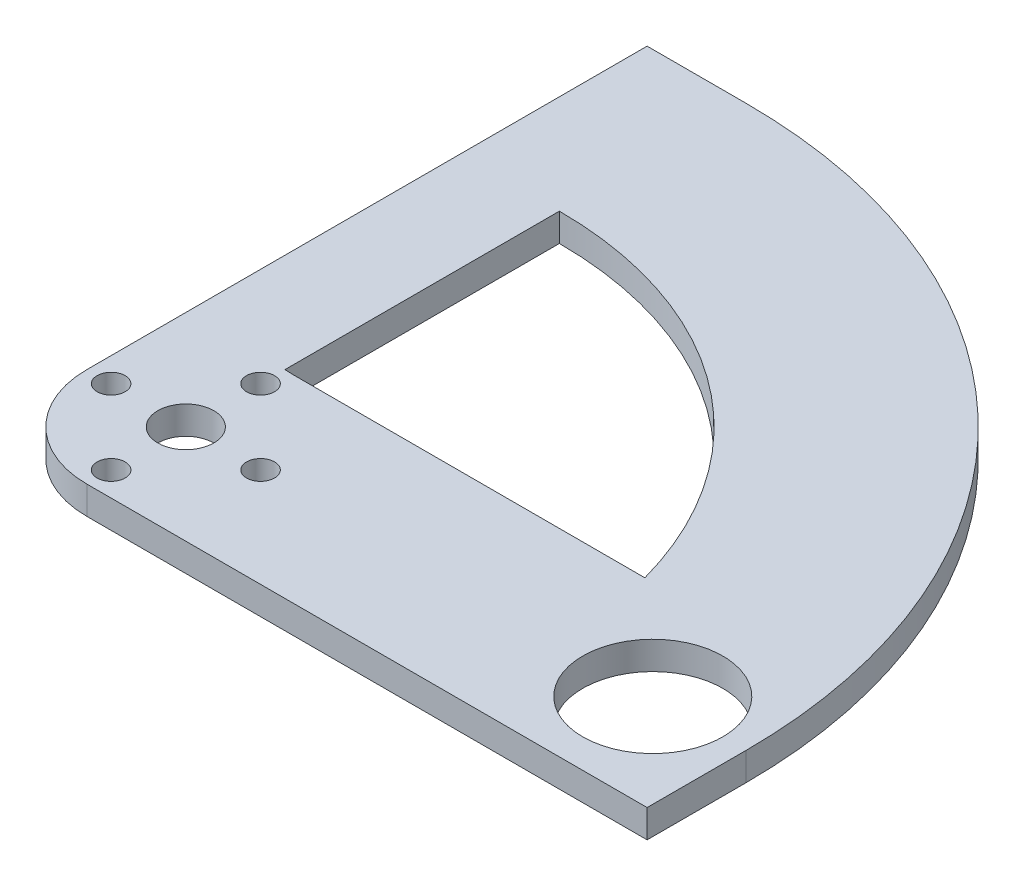
from build123d import *

# Parameters (mm, degrees)
SKETCH1_R             = 3
SKETCH1_R_2           = 7.5
BOSS_EXTRUDE1_DEPTH   = 3
CORTAR_EXTRUIR1_DEPTH = 85.905830189
CROQUIS2_R            = 1.5
CORTAR_EXTRUIR2_DEPTH = 85.905830189


with BuildPart() as part:
    # Sketch1 → Boss-Extrude1 (new body)
    with BuildSketch(Plane(origin=(0, 0, 0), x_dir=(1, 0, 0), z_dir=(0, 1, 0))):
        with BuildLine():
            Line((-10.606601718, 60), (-10.606601718, -10.606601718))
            Line((-10.606601718, -10.606601718), (60, -10.606601718))
            Line((60, -10.606601718), (60, 0))
            ThreePointArc((60, 0), (42.426406871, 42.426406871), (0, 60))
            Line((0, 60), (-10.606601718, 60))
        make_face()
        with Locations(Location((0, 0, 0), (0, 0, 270))):
            Circle(SKETCH1_R, mode=Mode.SUBTRACT)
        with Locations(Location((50, 0, 0), (0, 0, 270))):
            Circle(SKETCH1_R_2, mode=Mode.SUBTRACT)
    extrude(amount=BOSS_EXTRUDE1_DEPTH)

    # Croquis1 → Cortar-Extruir1 (cut, through all)
    with BuildSketch(Plane(origin=(0, 3, 0), x_dir=(1, 0, 0), z_dir=(0, 1, 0))):
        with BuildLine():
            ThreePointArc((0, 10.606601718), (0.38870443, 10.59947682), (0.776886642, 10.5781117))
            Line((0.776886642, 10.5781117), (38.575945262, 10.5781117))
            ThreePointArc((38.575945262, 10.5781117), (24.257736209, 31.805066169), (0, 40))
            Line((0, 40), (0, 10.606601718))
        make_face()
        with BuildLine():
            ThreePointArc((0, -10.606601718), (-7.5, -7.5), (-10.606601718, 0))
            Line((-10.606601718, 0), (-10.606601718, -10.606601718))
            Line((-10.606601718, -10.606601718), (0, -10.606601718))
        make_face()
    extrude(amount=-CORTAR_EXTRUIR1_DEPTH, mode=Mode.SUBTRACT)

    # Croquis2 → Cortar-Extruir2 (cut, through all)
    with BuildSketch(Plane(origin=(0, 3, 0), x_dir=(1, 0, 0), z_dir=(0, 1, 0))):
        with Locations(Location((8, 0, 0), (0, 0, 270))):
            Circle(CROQUIS2_R)
        with Locations(Location((0, -8, 0), (0, 0, 270))):
            Circle(CROQUIS2_R)
        with Locations(Location((-8, 0, 0), (0, 0, 270))):
            Circle(CROQUIS2_R)
        with Locations(Location((0, 8, 0), (0, 0, 270))):
            Circle(CROQUIS2_R)
    extrude(amount=-CORTAR_EXTRUIR2_DEPTH, mode=Mode.SUBTRACT)


solid = part.part
